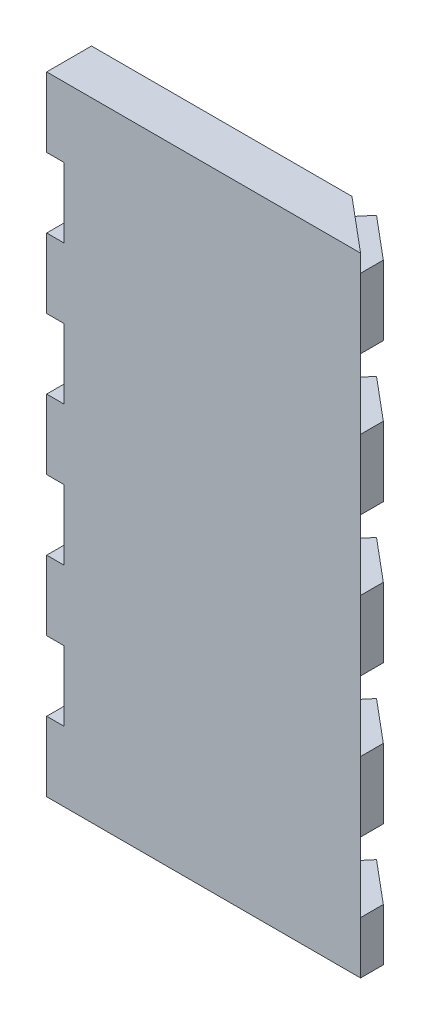
from build123d import *

# Parameters (mm, degrees)
BOSS_EXTRUDE1_DEPTH = 228.6
SKETCH2_W           = 25.4
SKETCH2_H           = 25.4
SKETCH2_H_2         = 19.05
BOSS_EXTRUDE2_DEPTH = 6.35
SKETCH3_W           = 25.4
SKETCH3_H           = 25.4
CUT_EXTRUDE1_DEPTH  = 228.6
SKETCH4_W           = 16.326805286
SKETCH4_H           = 25.4
BOSS_EXTRUDE3_DEPTH = 6.35


with BuildPart() as part:
    # Sketch1 → Boss-Extrude1 (new body)
    with BuildSketch(Plane(origin=(0, 0, 0), x_dir=(1, 0, 0), z_dir=(0, 1, 0))):
        Polygon((-53.975, 0), (53.975, 0), (34.517471145, 16.326805286), (-53.975, 16.326805286), align=None)
    extrude(amount=BOSS_EXTRUDE1_DEPTH)

    # Sketch2 → Boss-Extrude2 (add)
    with BuildSketch(Plane(origin=(22.301169805, 0, -26.577499234), x_dir=(-0.7660444431189819, 0, -0.6427876096865348), z_dir=(0.6427876096865348, 0, -0.7660444431189819))):
        with Locations((-28.647248817, 209.55)):
            Rectangle(SKETCH2_W, SKETCH2_H)
        with Locations((-28.647248817, 158.75)):
            Rectangle(SKETCH2_W, SKETCH2_H)
        with Locations((-28.647248817, 107.95)):
            Rectangle(SKETCH2_W, SKETCH2_H)
        with Locations((-28.647248817, 57.15)):
            Rectangle(SKETCH2_W, SKETCH2_H)
        with Locations((-28.647248817, 9.525)):
            Rectangle(SKETCH2_W, SKETCH2_H_2)
    extrude(amount=BOSS_EXTRUDE2_DEPTH)

    # Sketch3 → Cut-Extrude1 (cut)
    with BuildSketch(Plane(origin=(0, 228.6, 0), x_dir=(1, 0, 0), z_dir=(0, 1, 0))):
        with Locations((66.675, 12.7)):
            Rectangle(SKETCH3_W, SKETCH3_H)
    extrude(amount=-CUT_EXTRUDE1_DEPTH, mode=Mode.SUBTRACT)

    # Sketch4 → Boss-Extrude3 (add)
    with BuildSketch(Plane.ZY.offset(53.975)):
        with Locations((-8.163402643, 12.7)):
            Rectangle(SKETCH4_W, SKETCH4_H)
        with Locations((-8.163402643, 63.5)):
            Rectangle(SKETCH4_W, SKETCH4_H)
        with Locations((-8.163402643, 114.3)):
            Rectangle(SKETCH4_W, SKETCH4_H)
        with Locations((-8.163402643, 165.1)):
            Rectangle(SKETCH4_W, SKETCH4_H)
        with Locations((-8.163402643, 215.9)):
            Rectangle(SKETCH4_W, SKETCH4_H)
    extrude(amount=BOSS_EXTRUDE3_DEPTH)


solid = part.part
